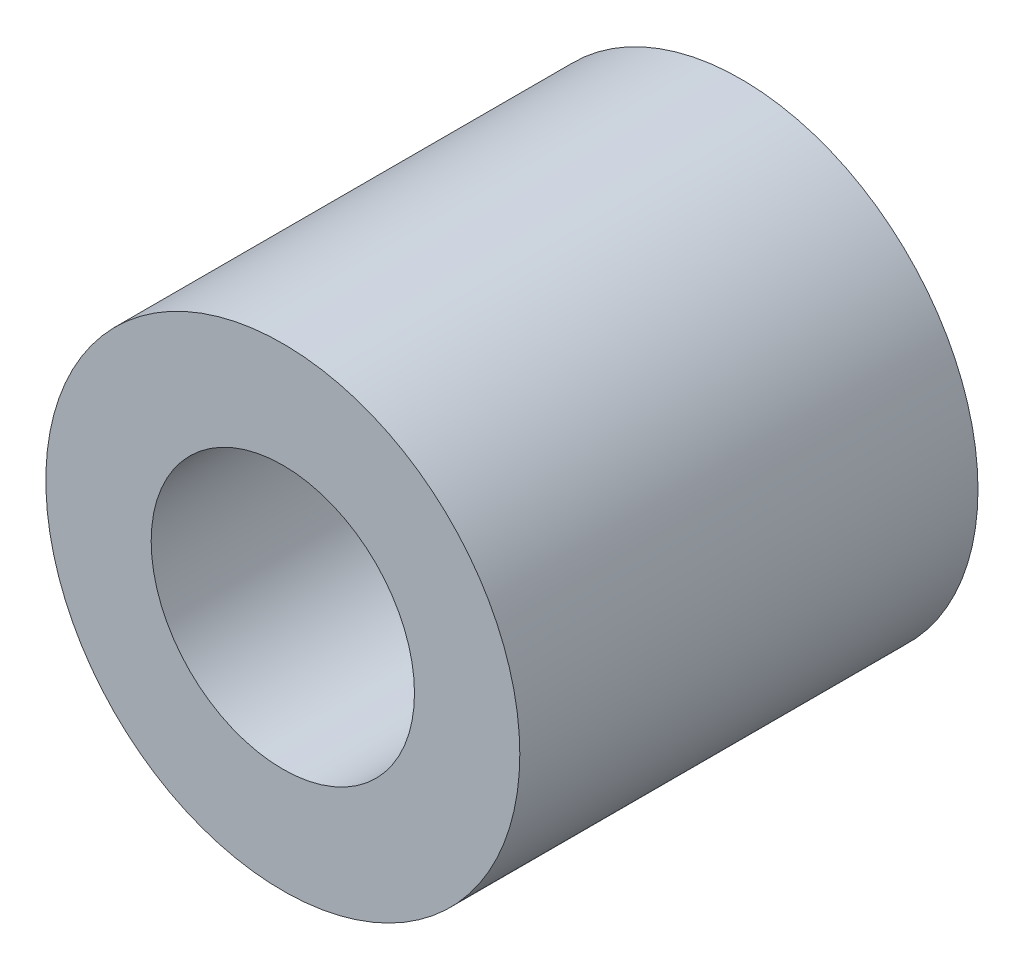
from build123d import *

# Parameters (mm, degrees)
SKETCH2_R           = 4.5
SKETCH2_R_2         = 2.5
BOSS_EXTRUDE1_DEPTH = 20
CUT_EXTRUDE1_START  = -11.3
SKETCH3_R           = 4.5
CUT_EXTRUDE1_DEPTH  = 11.3


with BuildPart() as part:
    # Sketch2 → Boss-Extrude1 (new body)
    with BuildSketch(Plane.XY):
        Circle(SKETCH2_R)
        Circle(SKETCH2_R_2, mode=Mode.SUBTRACT)
    extrude(amount=BOSS_EXTRUDE1_DEPTH)

    # Sketch3 → Cut-Extrude1 (cut)
    with BuildSketch(Plane.XY.offset(20).offset(CUT_EXTRUDE1_START)):
        Circle(SKETCH3_R)
    extrude(amount=CUT_EXTRUDE1_DEPTH, mode=Mode.SUBTRACT)


solid = part.part
